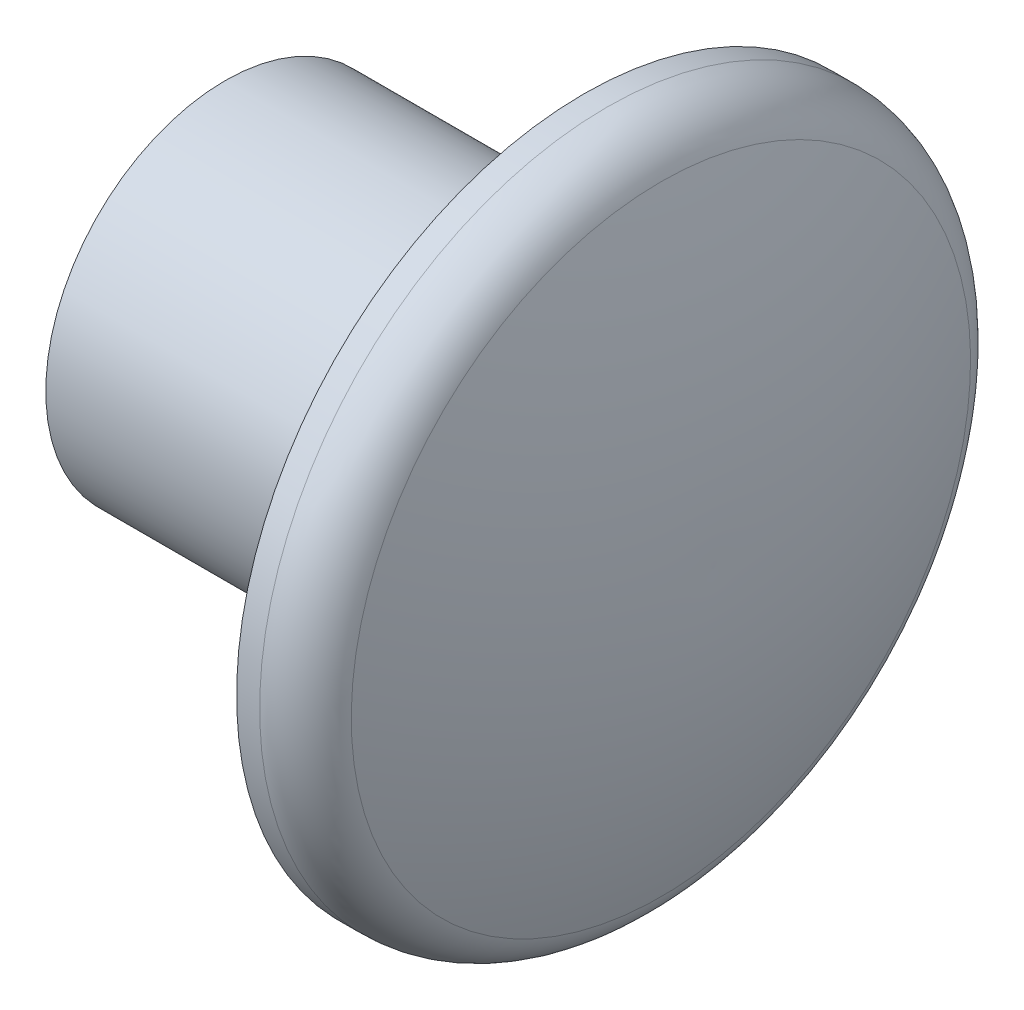
from build123d import *


with BuildPart() as part:
    # Sketch10 → Revolve1 (revolve)
    with BuildSketch(Plane(origin=(34.268160819, 0, 0), x_dir=(1, 0, 0), z_dir=(0, 0, 1)), mode=Mode.PRIVATE) as revolve1_sk:
        with BuildLine():
            Line((11.072297916, -46.719786358), (19.009797916, -46.719786358))
            Line((19.009797916, -46.719786358), (19.009797916, -50.435793708))
            Line((19.009797916, -50.435793708), (19.519662653, -50.435793708))
            ThreePointArc((19.519662653, -50.435793708), (20.247428005, -50.206590322), (20.712506298, -49.601711175))
            ThreePointArc((20.712506298, -49.601711175), (21.604837682, -46.229461232), (21.867297916, -42.751036358))
            Line((21.867297916, -42.751036358), (11.072297916, -42.751036358))
            Line((11.072297916, -42.751036358), (11.072297916, -46.719786358))
        make_face()
    revolve(revolve1_sk.sketch.rotate(Axis((56.135458735, -42.751036358, 0), (-1, 0, 0)), 180), axis=Axis((56.135458735, -42.751036358, 0), (-1, 0, 0)))


solid = part.part
